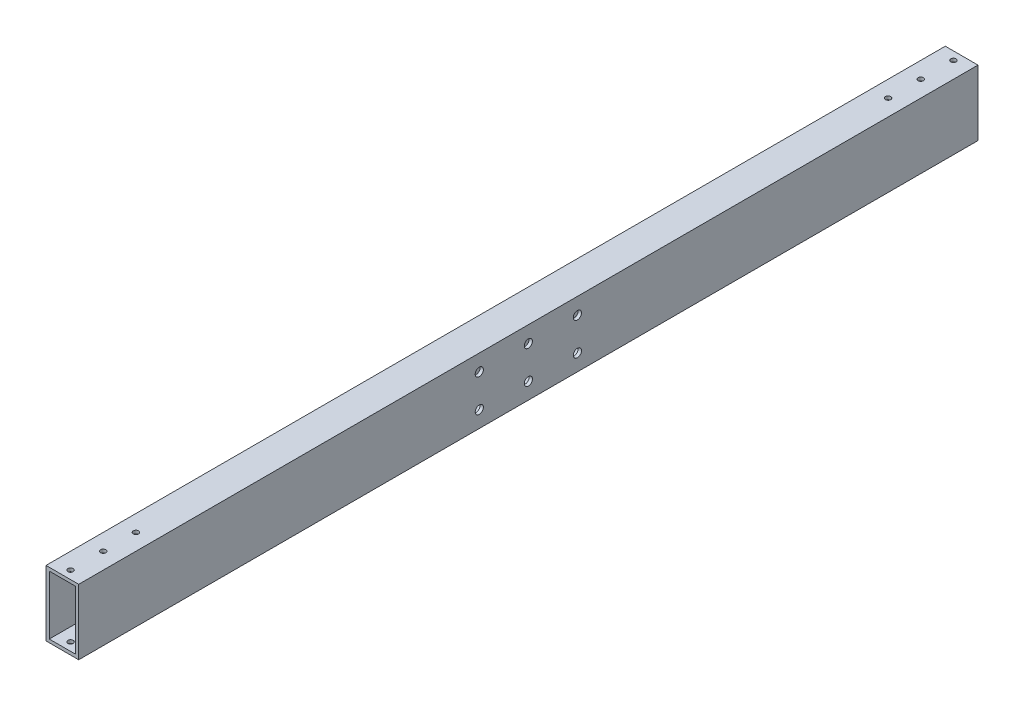
from build123d import *

# Parameters (mm, degrees)
SKETCH1_W           = 25.4
SKETCH1_H           = 50.8
SKETCH1_W_2         = 20.32
SKETCH1_H_2         = 45.72
EXTRUDE_THIN1_DEPTH = 698.5
SKETCH2_R           = 2.0701
CUT_EXTRUDE1_DEPTH  = 701.459977443
SKETCH3_R           = 3.175
CUT_EXTRUDE2_DEPTH  = 700.423026501


with BuildPart() as part:
    # Sketch1 → Extrude-Thin1 (new body)
    with BuildSketch(Plane.XY):
        Rectangle(SKETCH1_W, SKETCH1_H)
        Rectangle(SKETCH1_W_2, SKETCH1_H_2, mode=Mode.SUBTRACT)
    extrude(amount=EXTRUDE_THIN1_DEPTH)

    # Sketch2 → Cut-Extrude1 (cut, through all)
    with BuildSketch(Plane(origin=(0, 25.4, 0), x_dir=(1, 0, 0), z_dir=(0, 1, 0))):
        with Locations(Location((0, -6.35, 0), (0, 0, 270))):
            Circle(SKETCH2_R)
        with Locations(Location((0, -31.75, 0), (0, 0, 270))):
            Circle(SKETCH2_R)
        with Locations(Location((0, -57.15, 0), (0, 0, 270))):
            Circle(SKETCH2_R)
        with Locations(Location((0, -641.35, 0), (0, 0, 270))):
            Circle(SKETCH2_R)
        with Locations(Location((0, -666.75, 0), (0, 0, 270))):
            Circle(SKETCH2_R)
        with Locations(Location((0, -692.15, 0), (0, 0, 270))):
            Circle(SKETCH2_R)
    extrude(amount=-CUT_EXTRUDE1_DEPTH, mode=Mode.SUBTRACT)

    # Sketch3 → Cut-Extrude2 (cut, through all)
    with BuildSketch(Plane.ZY.offset(12.7)):
        with Locations((311.15, 12.7)):
            Circle(SKETCH3_R)
        with Locations((311.15, -12.7)):
            Circle(SKETCH3_R)
        with Locations((387.35, -12.7)):
            Circle(SKETCH3_R)
        with Locations((387.35, 12.7)):
            Circle(SKETCH3_R)
        with Locations((349.25, 12.7)):
            Circle(SKETCH3_R)
        with Locations((349.25, -12.7)):
            Circle(SKETCH3_R)
    extrude(amount=-CUT_EXTRUDE2_DEPTH, mode=Mode.SUBTRACT)


solid = part.part
